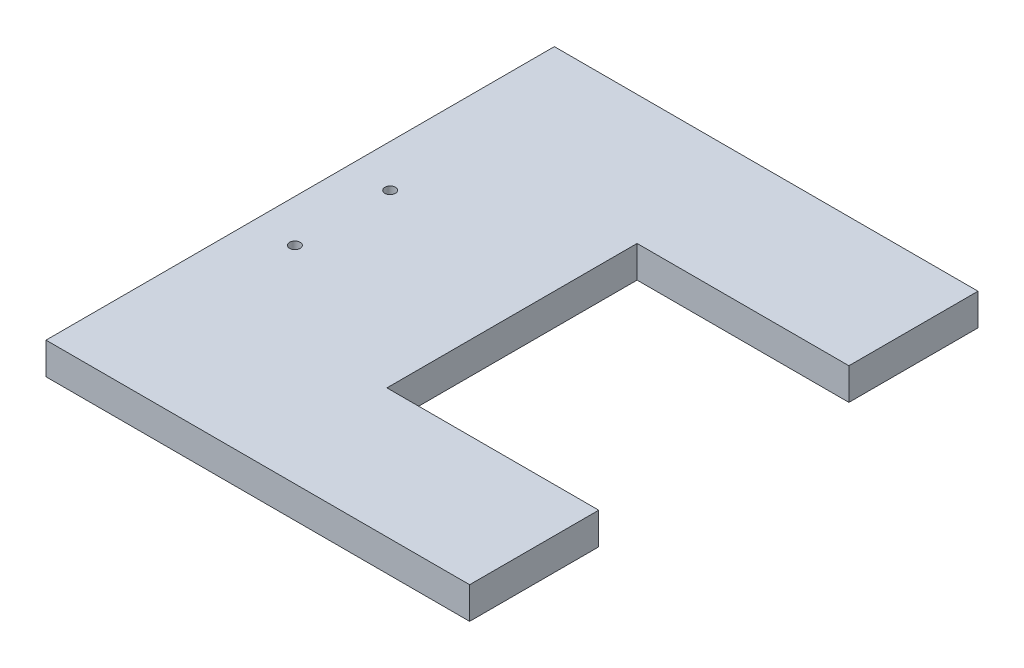
from build123d import *

# Parameters (mm, degrees)
BOSS_EXTRUDE2_DEPTH = 19.05
SKETCH3_R           = 3.175
CUT_EXTRUDE1_DEPTH  = 200.292906296


with BuildPart() as part:
    # Sketch1 → Boss-Extrude2 (new body)
    with BuildSketch(Plane(origin=(0, 0, 0), x_dir=(1, 0, 0), z_dir=(0, 1, 0))):
        Polygon((127, 152.4), (-127, 152.4), (-127, -152.4), (127, -152.4), (127, -75), (0, -75), (0, 75), (127, 75), align=None)
    extrude(amount=BOSS_EXTRUDE2_DEPTH)

    # Sketch3 → Cut-Extrude1 (cut, through all)
    with BuildSketch(Plane(origin=(0, 19.05, 0), x_dir=(1, 0, 0), z_dir=(0, 1, 0))):
        with Locations(Location((-101.6, 28.575, 0), (0, 0, 270))):
            Circle(SKETCH3_R)
        with Locations(Location((-101.6, -28.575, 0), (0, 0, 270))):
            Circle(SKETCH3_R)
    extrude(amount=-CUT_EXTRUDE1_DEPTH, mode=Mode.SUBTRACT)


solid = part.part
